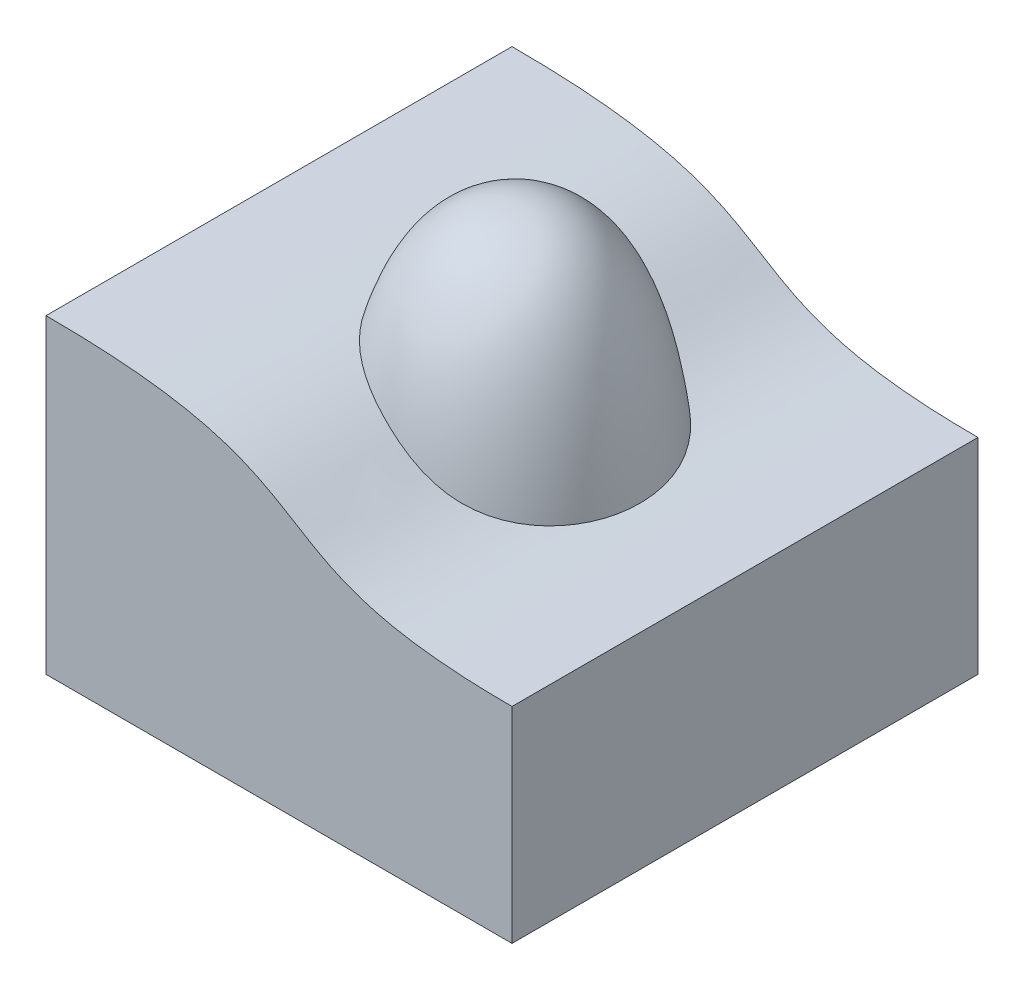
from build123d import *

# Parameters (mm, degrees)
BOSS_EXTRUDE1_DEPTH      = 38.1
BOSS_EXTRUDE1_DEPTH_BACK = 38.1
SKETCH1_W                = 76.2
SKETCH1_H                = 50.8
CUT_EXTRUDE1_DEPTH       = 120.1365603


with BuildPart() as part:
    # Sketch1 → Boss-Extrude1 (new, two sides: drawn at the far end of the back side and taken through both)
    with BuildSketch(Plane.XY.offset(-BOSS_EXTRUDE1_DEPTH_BACK)):
        with Locations((38.1, 25.4)):
            Rectangle(SKETCH1_W, SKETCH1_H)
    extrude(amount=BOSS_EXTRUDE1_DEPTH + BOSS_EXTRUDE1_DEPTH_BACK)

    # Sketch2 → Cut-Extrude1 (cut, through all)
    with BuildSketch(Plane.XY.offset(38.1)):
        with BuildLine():
            Line((0, 50.8), (76.2, 50.8))
            Line((76.2, 50.8), (76.2, 33.554716735))
            add(Edge.make_bspline(
                [(0, 50.8), (50.619099791, 50.8), (30.963551519, 33.554716735), (76.2, 33.554716735)],
                knots=[0, 0, 0, 0, 1, 1, 1, 1], degree=3))
        make_face()
    extrude(amount=-CUT_EXTRUDE1_DEPTH, mode=Mode.SUBTRACT)

    # Sketch3 → Revolve1 (revolve)
    with BuildSketch(Plane.XY):
        with BuildLine():
            Line((17.711739757, 28.999365941), (38.626183585, 28.999365941))
            Line((38.626183585, 28.999365941), (38.626183585, 66.983686716))
            add(Edge.make_bspline(
                [(38.626183585, 66.983686716), (20.189571229, 66.983686716), (17.711739757, 28.999365941)],
                knots=[0, 0, 0, 1, 1, 1], degree=2))
        make_face()
    revolve(axis=Axis((38.626183585, 75.672407866, 0), (0, -1, 0)))


solid = part.part
